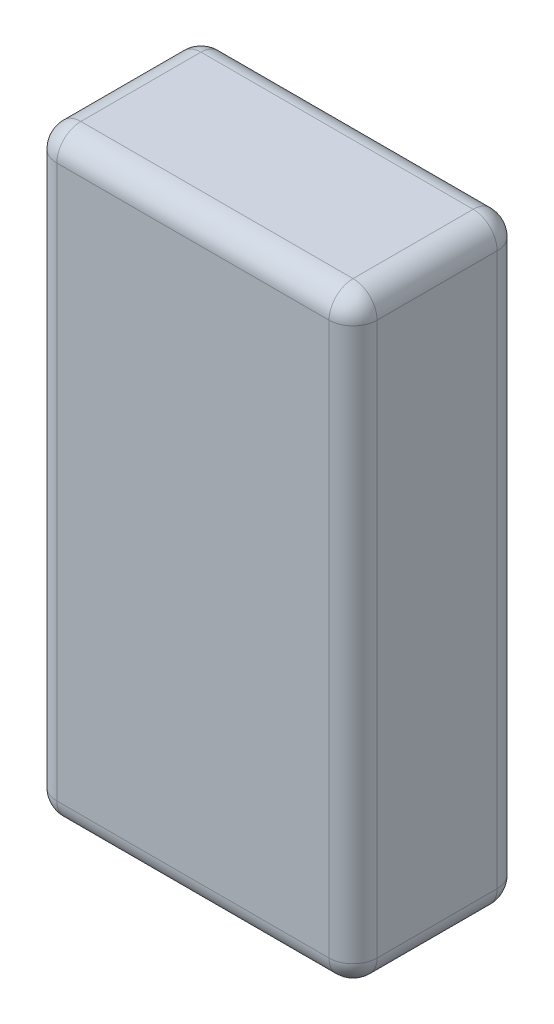
from build123d import *

# Parameters (mm, degrees)
SKETCH2_W           = 40
SKETCH2_H           = 75
BOSS_EXTRUDE1_DEPTH = 21
FILLET1_R           = 3


with BuildPart() as part:
    # Sketch2 → Boss-Extrude1 (new body)
    with BuildSketch(Plane.XY):
        Rectangle(SKETCH2_W, SKETCH2_H)
    extrude(amount=BOSS_EXTRUDE1_DEPTH)

    # Fillet1
    fillet1_edges = [part.edges().sort_by_distance(p)[0] for p in [
        (-20, 0, 21),
        (0, -37.5, 21),
        (20, 0, 21),
        (0, -37.5, 0),
        (-20, 0, 0),
        (0, 37.5, 0),
        (20, 0, 0),
        (20, -37.5, 10.5),
        (-20, -37.5, 10.5),
        (-20, 37.5, 10.5),
        (20, 37.5, 10.5),
        (0, 37.5, 21),
    ]]
    fillet(fillet1_edges, radius=FILLET1_R)


solid = part.part
